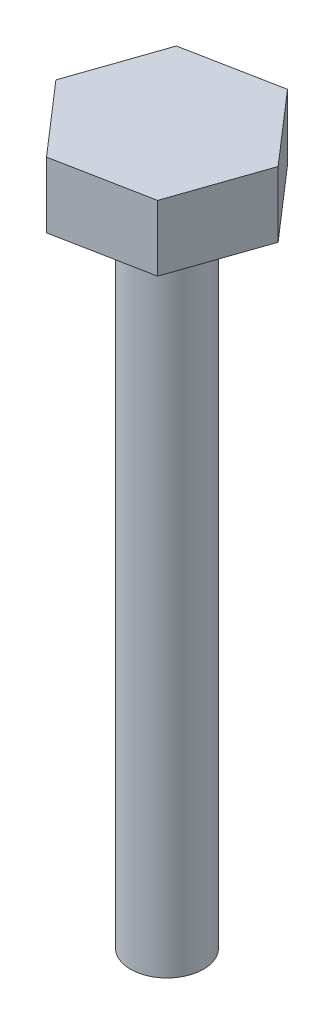
from build123d import *

# Parameters (mm, degrees)
SKETCH2_R                = 25
BOSS_EXTRUDE1_DEPTH      = 45
BOSS_EXTRUDE2_DEPTH      = 45
BOSS_EXTRUDE2_DEPTH_BACK = 445
SKETCH2_2_R              = 25


with BuildPart() as part:
    # Sketch2 → Boss-Extrude1 (new body)
    with BuildSketch(Plane(origin=(0, 0, 0), x_dir=(1, 0, 0), z_dir=(0, 1, 0))):
        Polygon((42.627068047, -49.070694612), (63.810002139, 12.380776511), (21.182934092, 61.451471124), (-42.627068047, 49.070694612), (-63.810002139, -12.380776511), (-21.182934092, -61.451471124), align=None)
        Circle(SKETCH2_R, mode=Mode.SUBTRACT)
    extrude(amount=BOSS_EXTRUDE1_DEPTH)

    # Sketch2<2> → Boss-Extrude2 (add, two sides: drawn at the far end of the back side and taken through both)
    with BuildSketch(Plane(origin=(0, 0, 0), x_dir=(1, 0, 0), z_dir=(0, 1, 0)).offset(-BOSS_EXTRUDE2_DEPTH_BACK)):
        Circle(SKETCH2_2_R)
    extrude(amount=BOSS_EXTRUDE2_DEPTH + BOSS_EXTRUDE2_DEPTH_BACK)


solid = part.part
